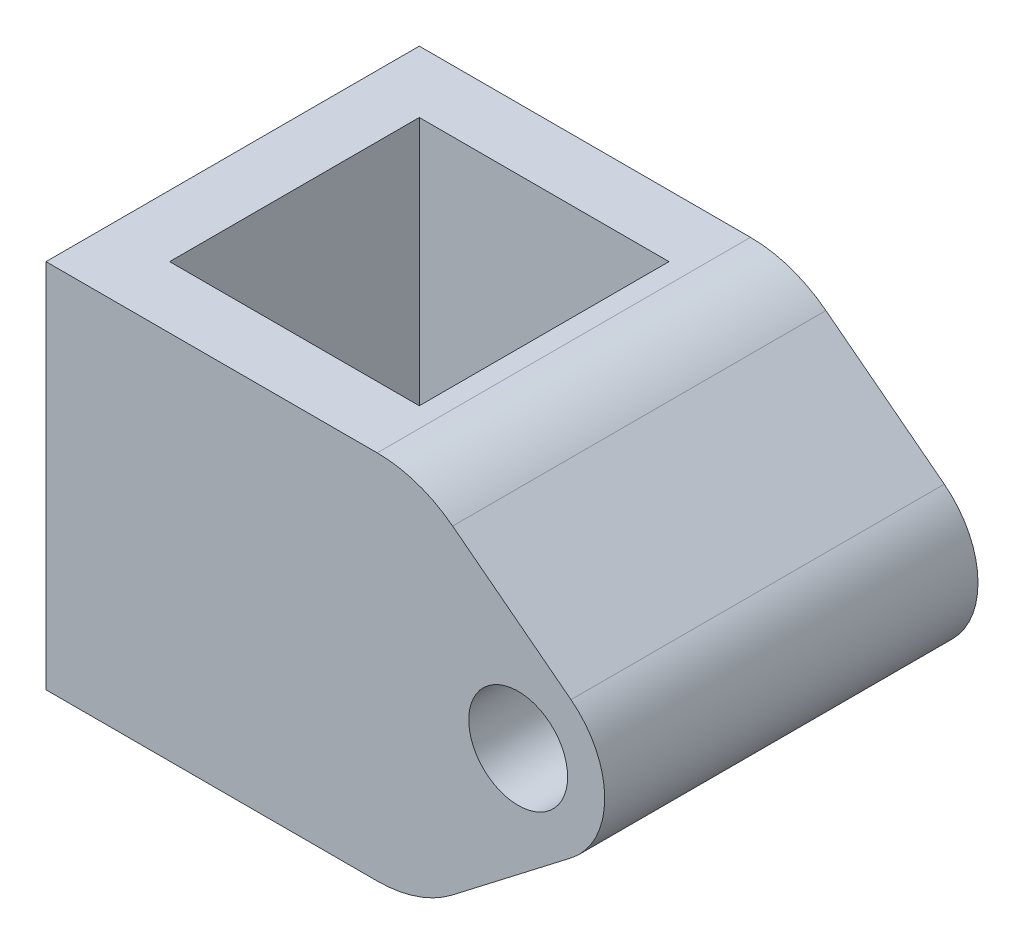
from build123d import *

# Parameters (mm, degrees)
SKETCH1_W           = 30.2
SKETCH1_H           = 30.2
SKETCH1_W_2         = 20.2
SKETCH1_H_2         = 20.2
EXTRUDE_THIN1_DEPTH = 30
SKETCH2_R           = 4
BOSS_EXTRUDE1_DEPTH = 30.2
FILLET1_R           = 10


with BuildPart() as part:
    # Sketch1 → Extrude-Thin1 (new body)
    with BuildSketch(Plane(origin=(0, 0, 0), x_dir=(1, 0, 0), z_dir=(0, 1, 0))):
        with Locations((10.1, 10.1)):
            Rectangle(SKETCH1_W, SKETCH1_H)
        with Locations((10.1, 10.1)):
            Rectangle(SKETCH1_W_2, SKETCH1_H_2, mode=Mode.SUBTRACT)
    extrude(amount=EXTRUDE_THIN1_DEPTH)

    # Sketch2 → Boss-Extrude1 (add)
    with BuildSketch(Plane.XY.offset(5)):
        with BuildLine():
            Line((37.472155728, 20.545149722), (25.2, 30))
            Line((25.2, 30), (25.2, 0))
            Line((25.2, 0), (37.472155728, 9.454850278))
            ThreePointArc((37.472155728, 9.454850278), (40.2, 15), (37.472155728, 20.545149722))
        make_face()
        with Locations((33.2, 15)):
            Circle(SKETCH2_R, mode=Mode.SUBTRACT)
    extrude(amount=-BOSS_EXTRUDE1_DEPTH)

    # Fillet1
    fillet1_edges = [part.edges().sort_by_distance(p)[0] for p in [
        (25.2, 30, -10.1),
        (25.2, 0, -10.1),
    ]]
    fillet(fillet1_edges, radius=FILLET1_R)


solid = part.part
